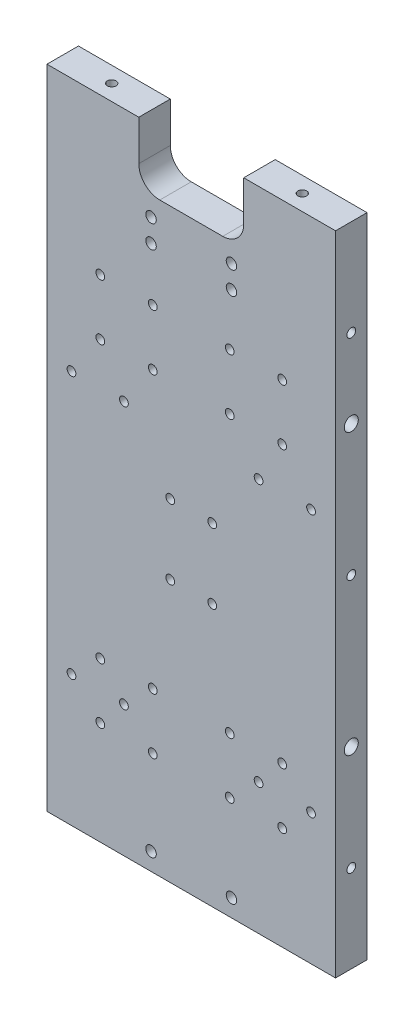
from build123d import *

# Parameters (mm, degrees)
SKETCH1_W                   = 165
SKETCH1_H                   = 350
BOSS_EXTRUDE1_DEPTH         = 18
F_6_0_6_DIAMETER_HOLE1_D    = 6
F_6_0_6_DIAMETER_HOLE2_D    = 6
OTW_R_5_0_5_1_D             = 5
SZKIC4_W                    = 165
SZKIC4_H                    = 20
DODANIE_WYCI_GNI_CIE3_DEPTH = 18
WYTNIJ_WYCI_GNI_CIE2_DEPTH  = 18
OTW_R_5_0_5_2_D             = 5
OTW_R_5_0_5_3_D             = 5
OTW_R_5_0_5_3_DEPTH         = 45
OTW_R_5_0_5_3_TIP           = 1.502151548
OTW_R_5_0_5_4_AT_2_COUNT    = 2
OTW_R_5_0_5_4_AT_2_PITCH    = 120
OTW_R_5_0_5_4_AT_3_COUNT    = 2
OTW_R_5_0_5_4_AT_3_PITCH    = 265
OTW_R_8_0_8_1_AT_2_COUNT    = 2
OTW_R_8_0_8_1_AT_2_PITCH    = 160


with BuildPart() as part:
    # Sketch1 → Boss-Extrude1 (new body)
    with BuildSketch(Plane.XY):
        Rectangle(SKETCH1_W, SKETCH1_H)
    extrude(amount=BOSS_EXTRUDE1_DEPTH)

    # Ø6.0 (6) Diameter Hole1 (through all)
    with Locations(Plane.XY.offset(18)):
        with Locations((-23, 149), (-23, 136), (23, 149), (23, 136)):
            Hole(F_6_0_6_DIAMETER_HOLE1_D / 2)

    # Ø6.0 (6) Diameter Hole2 (through all)
    with Locations(Plane.XY.offset(18)):
        with Locations((23, -165), (-23, -165)):
            Hole(F_6_0_6_DIAMETER_HOLE2_D / 2)

    # Otwór Ø5.0 (5)1 (through all)
    with Locations(Plane.XY.offset(18)):
        with Locations((-68.5, 50), (-38.5, 50), (-68.5, -100), (-38.5, -100), (68.5, 50), (38.5, 50), (68.5, -100), (38.5, -100)):
            Hole(OTW_R_5_0_5_1_D / 2)

    # Szkic4 → Dodanie-wyciągnięcie3 (add)
    with BuildSketch(Plane.XY.offset(18)):
        with Locations((0, 185)):
            Rectangle(SZKIC4_W, SZKIC4_H)
    extrude(amount=-DODANIE_WYCI_GNI_CIE3_DEPTH)

    # Szkic5 → Wytnij-wyciągnięcie2 (cut)
    with BuildSketch(Plane.XY.offset(18)):
        with BuildLine():
            Line((-30, 195), (30, 195))
            Line((30, 195), (30, 172))
            ThreePointArc((30, 172), (26.485281374, 163.514718626), (18, 160))
            Line((18, 160), (-18, 160))
            ThreePointArc((-18, 160), (-26.485281374, 163.514718626), (-30, 172))
            Line((-30, 172), (-30, 195))
        make_face()
    extrude(amount=-WYTNIJ_WYCI_GNI_CIE2_DEPTH, mode=Mode.SUBTRACT)

    # Otwór Ø5.0 (5)2 (through all)
    with Locations(Plane(origin=(0, 0, 0), x_dir=(-1, 0, 0), z_dir=(0, 0, -1))):
        with Locations((-52, 106), (-22, 106), (-52, 74), (-22, 74), (22, 106), (52, 106), (52, 74), (22, 74), (-12, 15), (12, 15), (12, -25), (-12, -25), (-52, -84), (-22, -84), (-52, -116), (-22, -116), (22, -84), (52, -84), (22, -116), (52, -116)):
            Hole(OTW_R_5_0_5_2_D / 2)

    # Otwór Ø5.0 (5)3
    with Locations(Plane(origin=(0, 195, 0), x_dir=(1, 0, 0), z_dir=(0, 1, 0))):
        with Locations((-54.5, -9), (54.5, -9)):
            Hole(OTW_R_5_0_5_3_D / 2, depth=OTW_R_5_0_5_3_DEPTH)
            with Locations((0, 0, -(OTW_R_5_0_5_3_DEPTH + OTW_R_5_0_5_3_TIP / 2))):  # 118° drill point
                Cone(0, OTW_R_5_0_5_3_D / 2, OTW_R_5_0_5_3_TIP, mode=Mode.SUBTRACT)

    # Szkic13 → Otwór Ø5.0 (5)4 (revolve, cut)
    with BuildSketch(Plane(origin=(82.5, 140, 9), x_dir=(0, 0, -1), z_dir=(0, 1, 0))):
        Polygon((0, 0), (0, 46.502151548), (2.5, 45), (2.5, 0), align=None)
    otw_r_5_0_5_4 = revolve(axis=Axis((88.85, 140, 9), (-1, 0, 0)), mode=Mode.SUBTRACT)

    # Otwór Ø5.0 (5)4 at 2: Otwór Ø5.0 (5)4 ×2
    with Locations(*[(0, -i * OTW_R_5_0_5_4_AT_2_PITCH, 0) for i in range(1, OTW_R_5_0_5_4_AT_2_COUNT)]):
        add(otw_r_5_0_5_4, mode=Mode.SUBTRACT)

    # Otwór Ø5.0 (5)4 at 3: Otwór Ø5.0 (5)4 ×2
    with Locations(*[(0, -i * OTW_R_5_0_5_4_AT_3_PITCH, 0) for i in range(1, OTW_R_5_0_5_4_AT_3_COUNT)]):
        add(otw_r_5_0_5_4, mode=Mode.SUBTRACT)

    # Lustro1: Otwór Ø5.0 (5)4 across plane
    add(otw_r_5_0_5_4.mirror(Plane.ZY), mode=Mode.SUBTRACT)

    # Lustro1 copy 1 sketch → Lustro1 copy 1 (revolve, cut)
    with BuildSketch(Plane(origin=(-82.5, 20, 9), x_dir=(0, 0, -1), z_dir=(0, 1, 0))):
        Polygon((0, 0), (0, -46.502151548), (2.5, -45), (2.5, 0), align=None)
    revolve(axis=Axis((-88.85, 20, 9), (-1, 0, 0)), mode=Mode.SUBTRACT)

    # Lustro1 copy 2 sketch → Lustro1 copy 2 (revolve, cut)
    with BuildSketch(Plane(origin=(-82.5, -125, 9), x_dir=(0, 0, -1), z_dir=(0, 1, 0))):
        Polygon((0, 0), (0, -46.502151548), (2.5, -45), (2.5, 0), align=None)
    revolve(axis=Axis((-88.85, -125, 9), (-1, 0, 0)), mode=Mode.SUBTRACT)

    # Szkic15 → Otwór Ø8.0 (8)1 (revolve, cut)
    with BuildSketch(Plane(origin=(-82.5, 95, 9), x_dir=(0, 0, 1), z_dir=(0, 1, 0))):
        Polygon((0, 0), (0, 24.403442476), (4, 22), (4, 0), align=None)
    otw_r_8_0_8_1 = revolve(axis=Axis((-88.85, 95, 9), (1, 0, 0)), mode=Mode.SUBTRACT)

    # Otwór Ø8.0 (8)1 at 2: Otwór Ø8.0 (8)1 ×2
    with Locations(*[(0, -i * OTW_R_8_0_8_1_AT_2_PITCH, 0) for i in range(1, OTW_R_8_0_8_1_AT_2_COUNT)]):
        add(otw_r_8_0_8_1, mode=Mode.SUBTRACT)

    # Lustro2: Otwór Ø8.0 (8)1 across plane
    add(otw_r_8_0_8_1.mirror(Plane.ZY), mode=Mode.SUBTRACT)

    # Lustro2 copy 1 sketch → Lustro2 copy 1 (revolve, cut)
    with BuildSketch(Plane(origin=(82.5, -65, 9), x_dir=(0, 0, 1), z_dir=(0, 1, 0))):
        Polygon((0, 0), (0, -24.403442476), (4, -22), (4, 0), align=None)
    revolve(axis=Axis((88.85, -65, 9), (1, 0, 0)), mode=Mode.SUBTRACT)


solid = part.part
